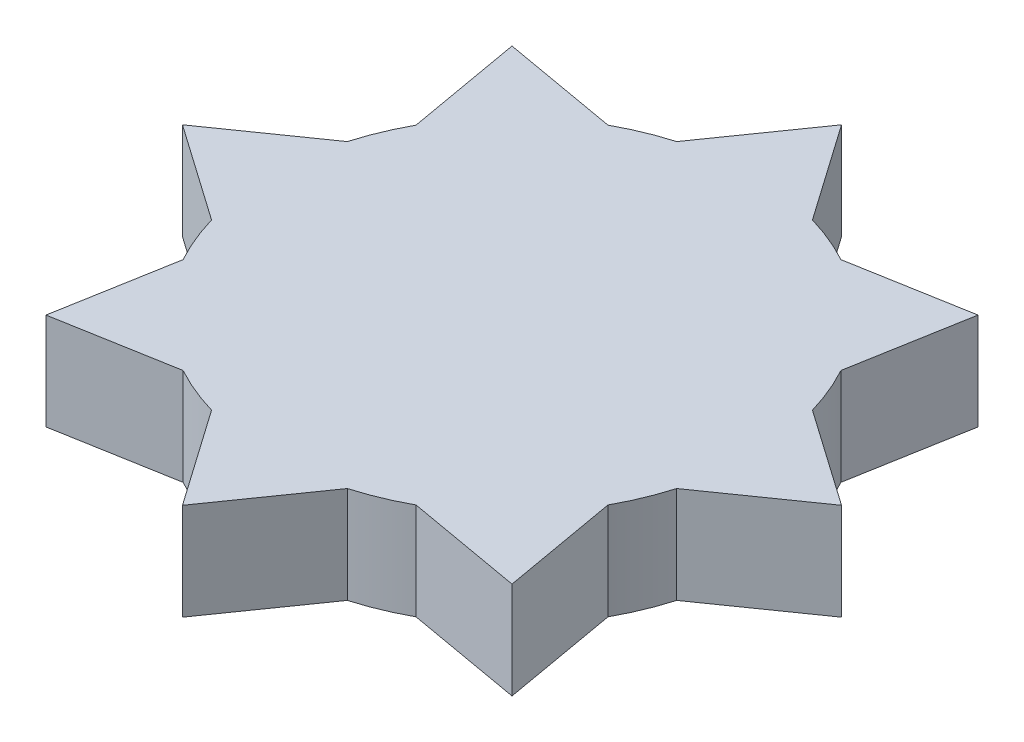
from build123d import *

# Parameters (mm, degrees)
BOSS_EXTRUDE1_DEPTH = 10


with BuildPart() as part:
    # Sketch1 → Boss-Extrude1 (new body)
    with BuildSketch(Plane(origin=(0, 0, 0), x_dir=(1, 0, 0), z_dir=(0, 1, 0))):
        with BuildLine():
            Line((7.002608144, 23.999239138), (0, 34))
            Line((0, 34), (-7.002608144, 23.999239138))
            ThreePointArc((-7.002608144, 23.999239138), (-9.567085809, 23.096988313), (-12.018433033, 21.921616442))
            Line((-12.018433033, 21.921616442), (-24.04163056, 24.04163056))
            Line((-24.04163056, 24.04163056), (-21.921616442, 12.018433033))
            ThreePointArc((-21.921616442, 12.018433033), (-23.096988313, 9.567085809), (-23.999239138, 7.002608144))
            Line((-23.999239138, 7.002608144), (-34, 0))
            Line((-34, 0), (-23.999239138, -7.002608144))
            ThreePointArc((-23.999239138, -7.002608144), (-23.096988313, -9.567085809), (-21.921616442, -12.018433033))
            Line((-21.921616442, -12.018433033), (-24.04163056, -24.04163056))
            Line((-24.04163056, -24.04163056), (-12.018433033, -21.921616442))
            ThreePointArc((-12.018433033, -21.921616442), (-9.567085809, -23.096988313), (-7.002608144, -23.999239138))
            Line((-7.002608144, -23.999239138), (0, -34))
            Line((0, -34), (7.002608144, -23.999239138))
            ThreePointArc((7.002608144, -23.999239138), (9.567085809, -23.096988313), (12.018433033, -21.921616442))
            Line((12.018433033, -21.921616442), (24.04163056, -24.04163056))
            Line((24.04163056, -24.04163056), (21.921616442, -12.018433033))
            ThreePointArc((21.921616442, -12.018433033), (23.096988313, -9.567085809), (23.999239138, -7.002608144))
            Line((23.999239138, -7.002608144), (34, 0))
            Line((34, 0), (23.999239138, 7.002608144))
            ThreePointArc((23.999239138, 7.002608144), (23.096988313, 9.567085809), (21.921616442, 12.018433033))
            Line((21.921616442, 12.018433033), (24.04163056, 24.04163056))
            Line((24.04163056, 24.04163056), (12.018433033, 21.921616442))
            ThreePointArc((12.018433033, 21.921616442), (9.567085809, 23.096988313), (7.002608144, 23.999239138))
        make_face()
    extrude(amount=BOSS_EXTRUDE1_DEPTH)


solid = part.part
